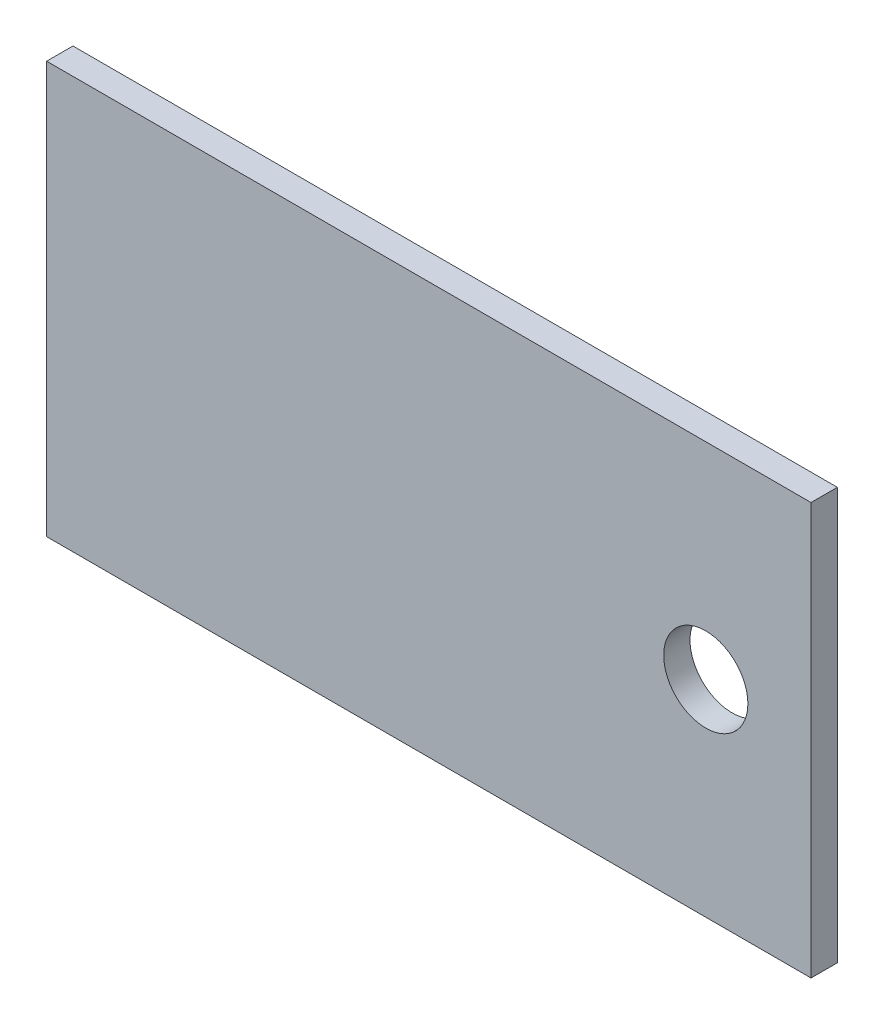
from build123d import *

# Parameters (mm, degrees)
IZIM1_W                     = 58.1
IZIM1_H                     = 31.3
Y_KSEKLIK_EKSTR_ZYON1_DEPTH = 2
IZIM2_R                     = 3.2
KES_EKSTR_ZYON1_DEPTH       = 2


with BuildPart() as part:
    # Çizim1 → Yükseklik-Ekstrüzyon1 (new body)
    with BuildSketch(Plane.XY):
        with Locations((29.05, 15.65)):
            Rectangle(IZIM1_W, IZIM1_H)
    extrude(amount=Y_KSEKLIK_EKSTR_ZYON1_DEPTH)

    # Çizim2 → Kes-Ekstrüzyon1 (cut)
    with BuildSketch(Plane.XY):
        with Locations((50.1, 15.65)):
            Circle(IZIM2_R)
    extrude(amount=KES_EKSTR_ZYON1_DEPTH, mode=Mode.SUBTRACT)


solid = part.part
